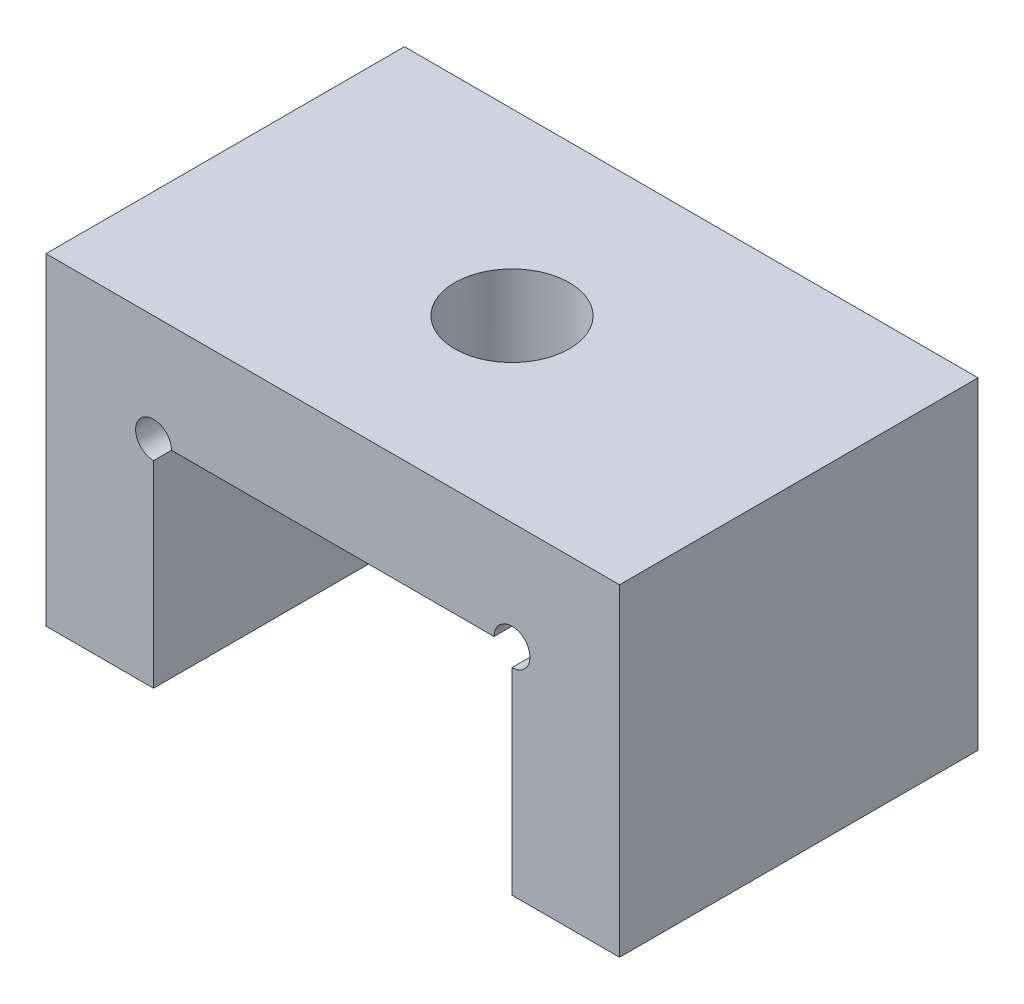
from build123d import *

# Parameters (mm, degrees)
EXTRUDE_1_DEPTH     = 10
SKETCH_2_R          = 1.6
CUT_EXTRUDE_1_DEPTH = 16.652475842
SKETCH_5_R          = 0.5
CUT_EXTRUDE_2_DEPTH = 16.652475842


with BuildPart() as part:
    # 草图1 → 凸台-拉伸1 (new body)
    with BuildSketch(Plane.XY):
        Polygon((0, 0), (-8, 0), (-8, -9), (-5, -9), (-5, -3), (5, -3), (5, -9), (8, -9), (8, 0), align=None)
    extrude(amount=EXTRUDE_1_DEPTH)

    # 草图2 → 切除-拉伸1 (cut, through all)
    with BuildSketch(Plane(origin=(0, 0, 0), x_dir=(1, 0, 0), z_dir=(0, 1, 0))):
        with Locations(Location((0, -5, 0), (0, 0, 270))):
            Circle(SKETCH_2_R)
    extrude(amount=-CUT_EXTRUDE_1_DEPTH, mode=Mode.SUBTRACT)

    # 草图5 → 切除-拉伸2 (cut, through all)
    with BuildSketch(Plane.XY.offset(10)):
        with Locations((-5, -3)):
            Circle(SKETCH_5_R)
        with Locations((5, -3)):
            Circle(SKETCH_5_R)
    extrude(amount=-CUT_EXTRUDE_2_DEPTH, mode=Mode.SUBTRACT)


solid = part.part
